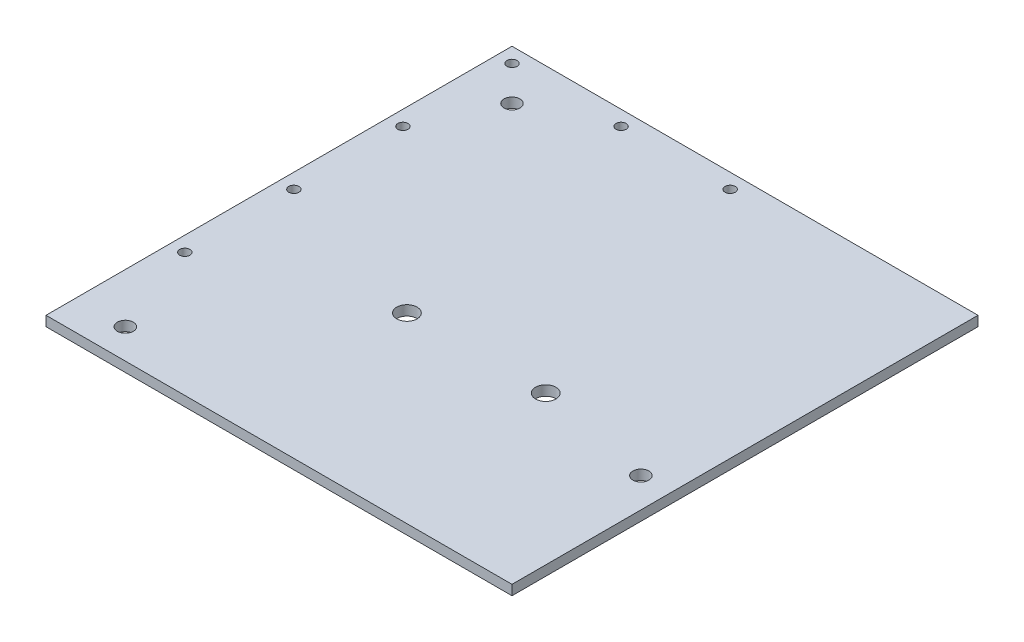
from build123d import *

# Parameters (mm, degrees)
BOSS_EXTRUDE1_DEPTH     = 1.5875
F_4_CLEARANCE_HOLE1_D   = 3.2639
F_10_CLEARANCE_HOLE1_D  = 5.1054
F_1_4_CLEARANCE_HOLE1_D = 6.5278


with BuildPart() as part:
    # Sketch1 → Boss-Extrude1 (new, symmetric)
    with BuildSketch(Plane(origin=(0, 0, 0), x_dir=(1, 0, 0), z_dir=(0, 1, 0))):
        Polygon((-69.85, -69.85), (-79.375, -69.85), (-79.375, 79.375), (69.85, 79.375), (69.85, 69.85), (69.85, -69.85), align=None)
    extrude(amount=BOSS_EXTRUDE1_DEPTH, both=True)

    # #4 Clearance Hole1 (through all)
    with Locations(Plane(origin=(0, 1.5875, 0), x_dir=(1, 0, 0), z_dir=(0, 1, 0))):
        with Locations((-74.6125, 4.7625), (-74.6125, 39.6875), (-74.6125, 74.6125), (-39.6875, 74.6125), (-4.7625, 74.6125), (-74.6125, -30.1625)):
            Hole(F_4_CLEARANCE_HOLE1_D / 2)

    # #10 Clearance Hole1 (through all)
    with Locations(Plane(origin=(0, 1.5875, 0), x_dir=(1, 0, 0), z_dir=(0, 1, 0))):
        with Locations((-63.5, -60.325), (-63.5, 63.5), (60.325, -19.05), (-22.225, -11.43), (22.225, -11.43)):
            Hole(F_10_CLEARANCE_HOLE1_D / 2)

    # 1/4 Clearance Hole1 (through all)
    with Locations(Plane(origin=(0, 1.5875, 0), x_dir=(1, 0, 0), z_dir=(0, 1, 0))):
        with Locations((-22.225, -11.43), (22.225, -11.43)):
            Hole(F_1_4_CLEARANCE_HOLE1_D / 2)


solid = part.part
